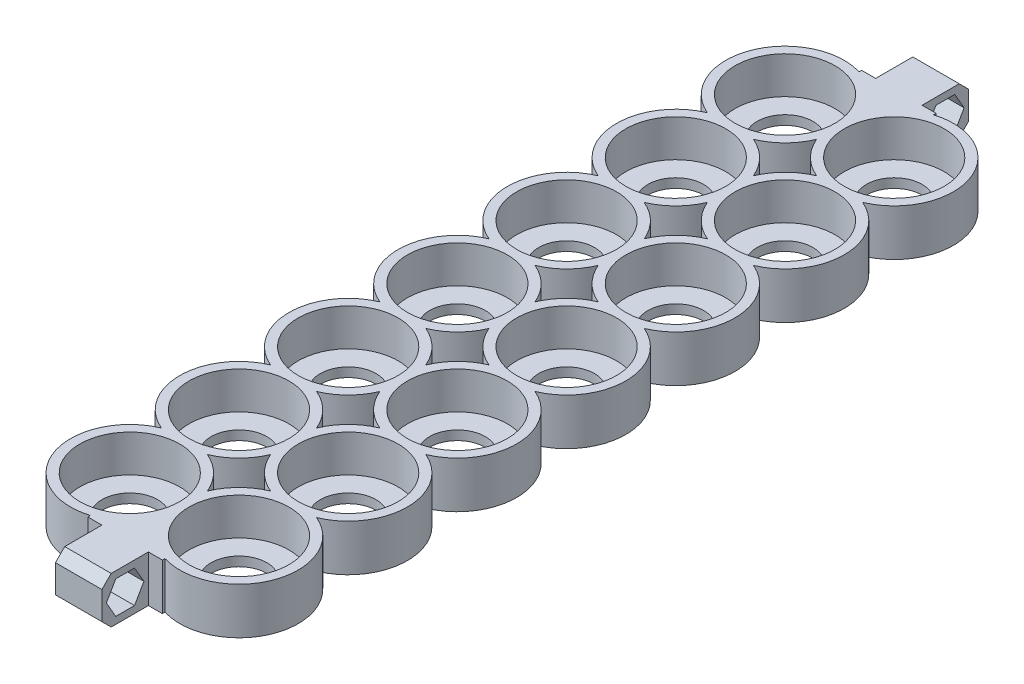
from build123d import *

# Parameters (mm, degrees)
LPATTERN1_COUNT          = 7
LPATTERN1_PITCH          = 23.5
LPATTERN2_COUNT          = 2
LPATTERN2_PITCH          = 23.5
BOSS_EXTRUDE1_REACH      = 172.474
SKETCH4_W                = 16.037131026
SKETCH4_H                = 10
SKETCH5_W                = 10
SKETCH5_H                = 10
BOSS_EXTRUDE2_DEPTH      = 10
CUT_EXTRUDE1_DEPTH       = 10
CHAMFER3_SIZE            = 2
CHAMFER3_OF_MIRROR2_SIZE = 2


with BuildPart() as part:
    # Sketch1 → Revolve1 (revolve)
    with BuildSketch(Plane(origin=(0, 0, 0), x_dir=(0, 0, -1), z_dir=(1, 0, 0))):
        Polygon((-12.75, 5), (-12.75, -5), (-6, -5), (-6, -3), (-10.75, -3), (-10.75, 5), align=None)
    revolve1 = revolve(axis=Axis((0, 27.077205882, 0), (0, -1, 0)))

    # LPattern1: Revolve1 ×7
    with Locations(*[(0, 0, -i * LPATTERN1_PITCH) for i in range(1, LPATTERN1_COUNT)]):
        add(revolve1)

    # LPattern2: Revolve1 ×2
    with Locations(*[(i * LPATTERN2_PITCH, 0, 0) for i in range(1, LPATTERN2_COUNT)]):
        add(revolve1)

    # LPattern2 copy 1 sketch → LPattern2 copy 1 (revolve)
    with BuildSketch(Plane(origin=(23.5, 0, -23.5), x_dir=(0, 0, -1), z_dir=(1, 0, 0))):
        Polygon((-12.75, 5), (-12.75, -5), (-6, -5), (-6, -3), (-10.75, -3), (-10.75, 5), align=None)
    revolve(axis=Axis((23.5, 27.077205882, -23.5), (0, -1, 0)))

    # LPattern2 copy 2 sketch → LPattern2 copy 2 (revolve)
    with BuildSketch(Plane(origin=(23.5, 0, -47), x_dir=(0, 0, -1), z_dir=(1, 0, 0))):
        Polygon((-12.75, 5), (-12.75, -5), (-6, -5), (-6, -3), (-10.75, -3), (-10.75, 5), align=None)
    revolve(axis=Axis((23.5, 27.077205882, -47), (0, -1, 0)))

    # LPattern2 copy 3 sketch → LPattern2 copy 3 (revolve)
    with BuildSketch(Plane(origin=(23.5, 0, -70.5), x_dir=(0, 0, -1), z_dir=(1, 0, 0))):
        Polygon((-12.75, 5), (-12.75, -5), (-6, -5), (-6, -3), (-10.75, -3), (-10.75, 5), align=None)
    revolve(axis=Axis((23.5, 27.077205882, -70.5), (0, -1, 0)))

    # LPattern2 copy 4 sketch → LPattern2 copy 4 (revolve)
    with BuildSketch(Plane(origin=(23.5, 0, -94), x_dir=(0, 0, -1), z_dir=(1, 0, 0))):
        Polygon((-12.75, 5), (-12.75, -5), (-6, -5), (-6, -3), (-10.75, -3), (-10.75, 5), align=None)
    revolve(axis=Axis((23.5, 27.077205882, -94), (0, -1, 0)))

    # LPattern2 copy 5 sketch → LPattern2 copy 5 (revolve)
    with BuildSketch(Plane(origin=(23.5, 0, -117.5), x_dir=(0, 0, -1), z_dir=(1, 0, 0))):
        Polygon((-12.75, 5), (-12.75, -5), (-6, -5), (-6, -3), (-10.75, -3), (-10.75, 5), align=None)
    revolve(axis=Axis((23.5, 27.077205882, -117.5), (0, -1, 0)))

    # LPattern2 copy 6 sketch → LPattern2 copy 6 (revolve)
    with BuildSketch(Plane(origin=(23.5, 0, -141), x_dir=(0, 0, -1), z_dir=(1, 0, 0))):
        Polygon((-12.75, 5), (-12.75, -5), (-6, -5), (-6, -3), (-10.75, -3), (-10.75, 5), align=None)
    revolve(axis=Axis((23.5, 27.077205882, -141), (0, -1, 0)))

    # Sketch4 → Boss-Extrude1 (add, up to next)
    with BuildSketch(Plane.XY.offset(12.75), mode=Mode.PRIVATE) as boss_extrude1_sk1:
        with Locations((11.75, 0)):
            Rectangle(SKETCH4_W, SKETCH4_H)
    boss_extrude1_tool1 = extrude(boss_extrude1_sk1.sketch, amount=-BOSS_EXTRUDE1_REACH, mode=Mode.PRIVATE) - part.part
    boss_extrude1 = boss_extrude1_tool1.solids().sort_by_distance((11.75, 0, 12.75))[0]
    add(boss_extrude1)

    # Sketch5 → Boss-Extrude2 (add)
    with BuildSketch(Plane.XY.offset(12.75)):
        with Locations((11.75, 0)):
            Rectangle(SKETCH5_W, SKETCH5_H)
    boss_extrude2 = extrude(amount=BOSS_EXTRUDE2_DEPTH)

    # Sketch8 → Cut-Extrude1 (cut)
    with BuildSketch(Plane.ZY.offset(-6.75)):
        Polygon((19.770725942, -3.5), (21.791451884, 0), (19.770725942, 3.5), (15.729274058, 3.5), (13.708548116, 0), (15.729274058, -3.5), align=None)
    cut_extrude1 = extrude(amount=-CUT_EXTRUDE1_DEPTH, mode=Mode.SUBTRACT)

    # Chamfer3
    chamfer3_edges = [part.edges().sort_by_distance(p)[0] for p in [
        (11.75, -5, 22.75),
        (11.75, 5, 22.75),
    ]]
    chamfer(chamfer3_edges, length=CHAMFER3_SIZE)

    # Mirror2: Boss-Extrude1, Boss-Extrude2, Cut-Extrude1 across plane
    add(boss_extrude1.mirror(Plane.XY.offset(-70.5)))
    add(boss_extrude2.mirror(Plane.XY.offset(-70.5)))
    add(cut_extrude1.mirror(Plane.XY.offset(-70.5)), mode=Mode.SUBTRACT)

    # Chamfer3 of Mirror2
    chamfer3_of_mirror2_edges = [part.edges().sort_by_distance(p)[0] for p in [
        (11.75, -5, -163.75),
        (11.75, 5, -163.75),
    ]]
    chamfer(chamfer3_of_mirror2_edges, length=CHAMFER3_OF_MIRROR2_SIZE)


solid = part.part
